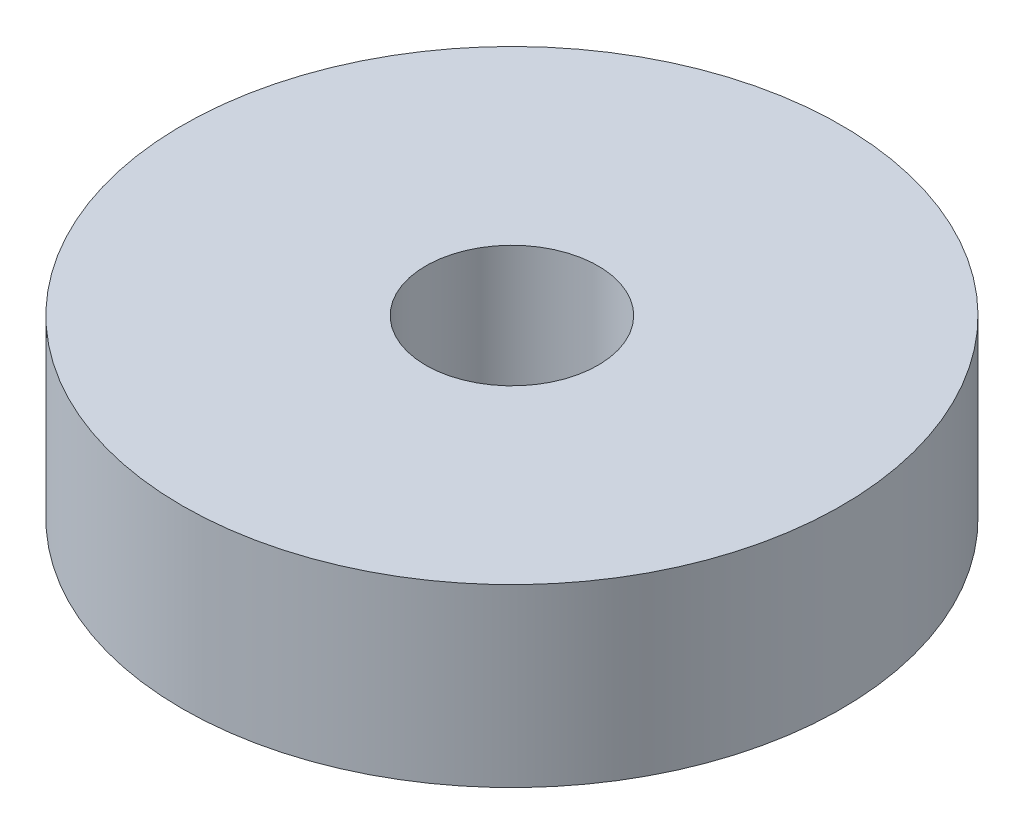
from build123d import *

# Parameters (mm, degrees)
SKETCH1_R              = 9.525
BOSS_EXTRUDE1_DEPTH    = 5.08
F_10_CLEARANCE_HOLE1_D = 4.9784


with BuildPart() as part:
    # Sketch1 → Boss-Extrude1 (new body)
    with BuildSketch(Plane(origin=(0, 0, 0), x_dir=(1, 0, 0), z_dir=(0, 1, 0))):
        with Locations(Location((0, 0, 0), (0, 0, 270))):
            Circle(SKETCH1_R)
    extrude(amount=BOSS_EXTRUDE1_DEPTH)

    # #10 Clearance Hole1 (through all)
    with Locations(Plane(origin=(0, 5.08, 0), x_dir=(1, 0, 0), z_dir=(0, 1, 0))):
        with Locations((0, 0)):
            Hole(F_10_CLEARANCE_HOLE1_D / 2)


solid = part.part
